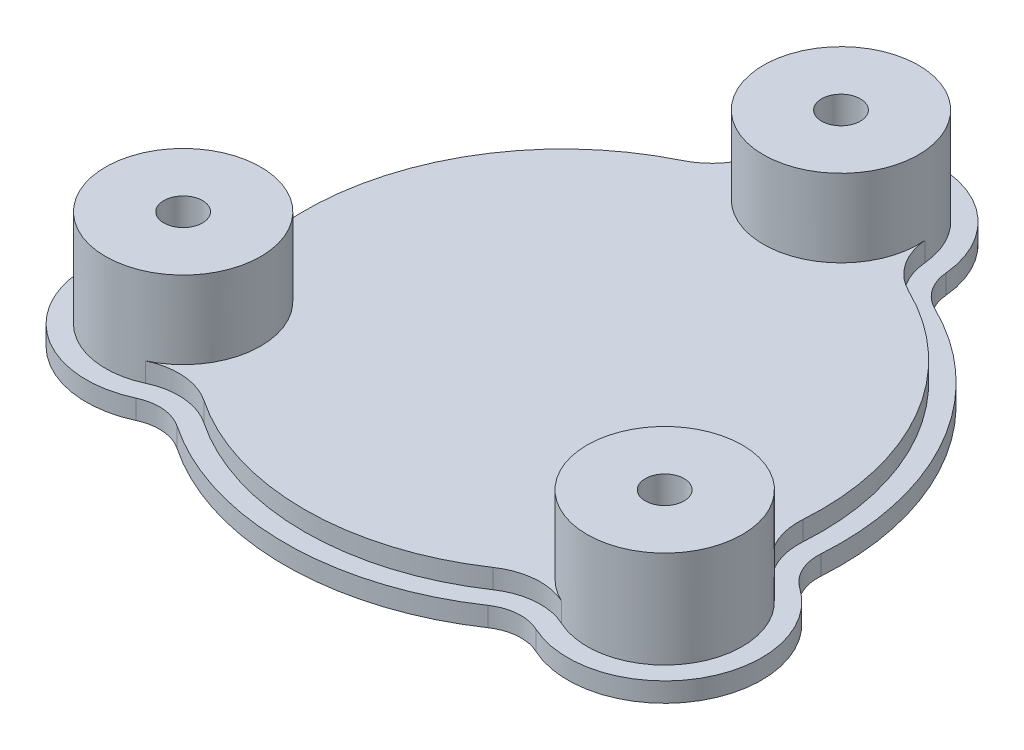
from build123d import *

# Parameters (mm, degrees)
SZKIC1_R                    = 6
DODANIE_WYCI_GNI_CIE3_DEPTH = 3
SZKIC2_R                    = 6
DODANIE_WYCI_GNI_CIE5_DEPTH = 3
SZKIC3_R                    = 12
DODANIE_WYCI_GNI_CIE7_DEPTH = 12
SZKIC4_R                    = 3
WYTNIJ_WYCI_GNI_CIE1_DEPTH  = 6
SZKIC5_R                    = 6
WYTNIJ_WYCI_GNI_CIE2_DEPTH  = 6


with BuildPart() as part:
    # Szkic1 → Dodanie-wyciągnięcie3 (new body)
    with BuildSketch(Plane(origin=(0, 0, 0), x_dir=(1, 0, 0), z_dir=(0, 1, 0))):
        with BuildLine():
            ThreePointArc((18.846153454, 38.65), (16.147655157, 40.973517523), (14.941453584, 44.323995772))
            ThreePointArc((14.941453584, 44.323995772), (0, 58), (-14.941453584, 44.323995772))
            ThreePointArc((-14.941453584, 44.323995772), (-16.147655157, 40.973517523), (-18.846153454, 38.65))
            ThreePointArc((-18.846153454, 38.65), (-37.579169087, 20.89990552), (-42.776535296, -4.378130663))
            ThreePointArc((-42.776535296, -4.378130663), (-43.223069571, -6.802925196), (-44.904285151, -8.606403934))
            ThreePointArc((-44.904285151, -8.606403934), (-50.503687636, -28.503607088), (-30.914979544, -35.101676259))
            ThreePointArc((-30.914979544, -35.101676259), (-27.410279478, -34.471038339), (-24.048805129, -35.646247655))
            ThreePointArc((-24.048805129, -35.646247655), (0, -43), (24.048805129, -35.646247655))
            ThreePointArc((24.048805129, -35.646247655), (27.410279478, -34.471038339), (30.914979544, -35.101676259))
            ThreePointArc((30.914979544, -35.101676259), (50.229473419, -29), (45.856433127, -9.222319513))
            ThreePointArc((45.856433127, -9.222319513), (43.557934635, -6.502479184), (42.894958583, -3.003752345))
            ThreePointArc((42.894958583, -3.003752345), (37.239092363, 21.5), (18.846153454, 38.65))
        make_face()
        with Locations(Location((0, 43, 0), (0, 0, 270))):
            Circle(SZKIC1_R, mode=Mode.SUBTRACT)
        with Locations(Location((37.239092363, -21.5, 0), (0, 0, 270))):
            Circle(SZKIC1_R, mode=Mode.SUBTRACT)
        with Locations(Location((-37.239092363, -21.5, 0), (0, 0, 270))):
            Circle(SZKIC1_R, mode=Mode.SUBTRACT)
    extrude(amount=DODANIE_WYCI_GNI_CIE3_DEPTH)

    # Szkic2 → Dodanie-wyciągnięcie5 (add)
    with BuildSketch(Plane(origin=(0, 3, 0), x_dir=(1, 0, 0), z_dir=(0, 1, 0))):
        with BuildLine():
            ThreePointArc((32.179802107, -32.381341007), (27.173087728, -31.480429693), (22.370981516, -33.159300144))
            ThreePointArc((22.370981516, -33.159300144), (0, -40), (-22.370981516, -33.159300144))
            ThreePointArc((-22.370981516, -33.159300144), (-27.173087728, -31.480429693), (-32.179802107, -32.381341007))
            ThreePointArc((-32.179802107, -32.381341007), (-47.850768581, -27.10288567), (-43.371246594, -11.185123147))
            ThreePointArc((-43.371246594, -11.185123147), (-40.543248024, -8.151463841), (-39.792125856, -4.072679686))
            ThreePointArc((-39.792125856, -4.072679686), (-34.957366592, 19.441772577), (-17.531305538, 35.953488372))
            ThreePointArc((-17.531305538, 35.953488372), (-13.676307972, 39.272799119), (-11.953162867, 44.059196617))
            ThreePointArc((-11.953162867, 44.059196617), (0, 55), (11.953162867, 44.059196617))
            ThreePointArc((11.953162867, 44.059196617), (13.676307972, 39.272799119), (17.531305538, 35.953488372))
            ThreePointArc((17.531305538, 35.953488372), (34.641016151, 20), (39.902287054, -2.794188228))
            ThreePointArc((39.902287054, -2.794188228), (40.8493957, -7.792369426), (44.132964974, -11.67785561))
            ThreePointArc((44.132964974, -11.67785561), (47.631397208, -27.5), (32.179802107, -32.381341007))
        make_face()
        with Locations(Location((37.239092363, -21.5, 0), (0, 0, 270))):
            Circle(SZKIC2_R, mode=Mode.SUBTRACT)
        with Locations(Location((0, 43, 0), (0, 0, 270))):
            Circle(SZKIC2_R, mode=Mode.SUBTRACT)
        with Locations(Location((-37.239092363, -21.5, 0), (0, 0, 270))):
            Circle(SZKIC2_R, mode=Mode.SUBTRACT)
    extrude(amount=DODANIE_WYCI_GNI_CIE5_DEPTH)

    # Szkic3 → Dodanie-wyciągnięcie7 (add)
    with BuildSketch(Plane(origin=(0, 6, 0), x_dir=(1, 0, 0), z_dir=(0, 1, 0))):
        with Locations(Location((0, 43, 0), (0, 0, 5.063881306))):
            Circle(SZKIC3_R)
        with Locations(Location((37.239092363, -21.5, 0), (0, 0, 54.936118694))):
            Circle(SZKIC3_R)
        with Locations(Location((-37.239092363, -21.5, 0), (0, 0, 120.73131892))):
            Circle(SZKIC3_R)
    extrude(amount=DODANIE_WYCI_GNI_CIE7_DEPTH)

    # Szkic4 → Wytnij-wyciągnięcie1 (cut)
    with BuildSketch(Plane(origin=(0, 18, 0), x_dir=(1, 0, 0), z_dir=(0, 1, 0))):
        with Locations(Location((0, 43, 0), (0, 0, 270))):
            Circle(SZKIC4_R)
        with Locations(Location((37.239092363, -21.5, 0), (0, 0, 270))):
            Circle(SZKIC4_R)
        with Locations(Location((-37.239092363, -21.5, 0), (0, 0, 270))):
            Circle(SZKIC4_R)
    extrude(amount=-WYTNIJ_WYCI_GNI_CIE1_DEPTH, mode=Mode.SUBTRACT)

    # Szkic5 → Wytnij-wyciągnięcie2 (cut)
    with BuildSketch(Plane.XZ.offset(-6)):
        with Locations(Location((37.239092363, 21.5, 0), (0, 0, 270))):
            Circle(SZKIC5_R)
        with Locations(Location((0, -43, 0), (0, 0, 270))):
            Circle(SZKIC5_R)
        with Locations(Location((-37.239092363, 21.5, 0), (0, 0, 270))):
            Circle(SZKIC5_R)
    extrude(amount=-WYTNIJ_WYCI_GNI_CIE2_DEPTH, mode=Mode.SUBTRACT)


solid = part.part
